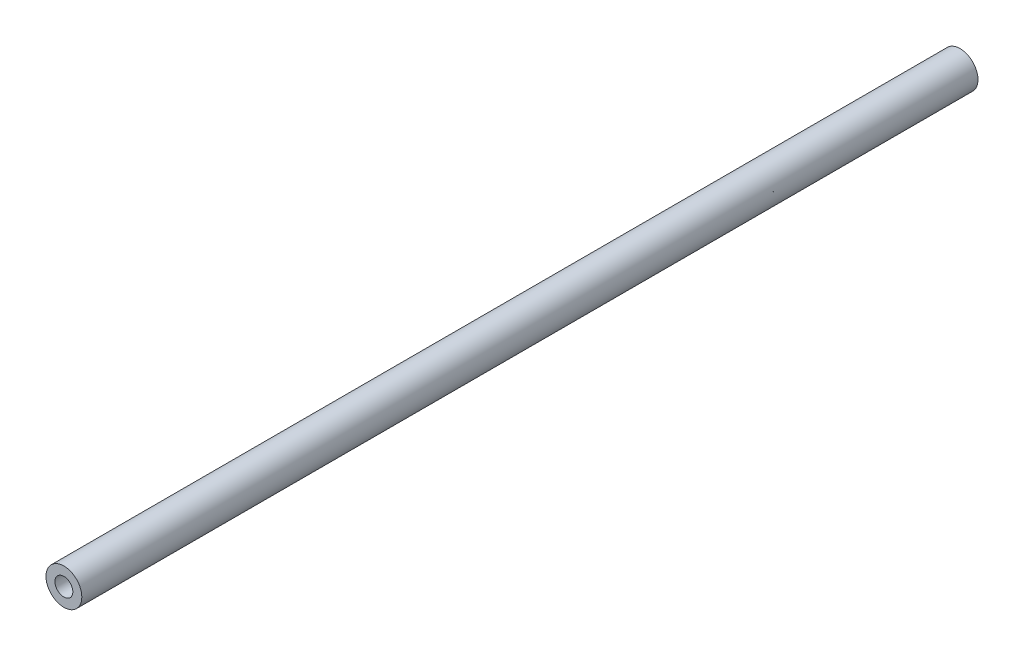
from build123d import *

# Parameters (mm, degrees)
SKETCH_1_R               = 4
EXTRUDE_1_DEPTH          = 200
CUT_EXTRUDE_1_DEPTH      = 201.079984006
CUT_EXTRUDE_1_DEPTH_BACK = 201.079984006
SKETCH_2_R               = 2


with BuildPart() as part:
    # 草图1 → 凸台-拉伸1 (new body)
    with BuildSketch(Plane.XY):
        Circle(SKETCH_1_R)
    extrude(amount=EXTRUDE_1_DEPTH)

    # 草图2 → 切除-拉伸1 (cut, two sides: drawn at the far end of the back side and taken through both)
    with BuildSketch(Plane(origin=(0, 0, 0), x_dir=(-1, 0, 0), z_dir=(0, 0, -1)).offset(-CUT_EXTRUDE_1_DEPTH_BACK)):
        Circle(SKETCH_2_R)
    extrude(amount=CUT_EXTRUDE_1_DEPTH + CUT_EXTRUDE_1_DEPTH_BACK, mode=Mode.SUBTRACT)


solid = part.part
